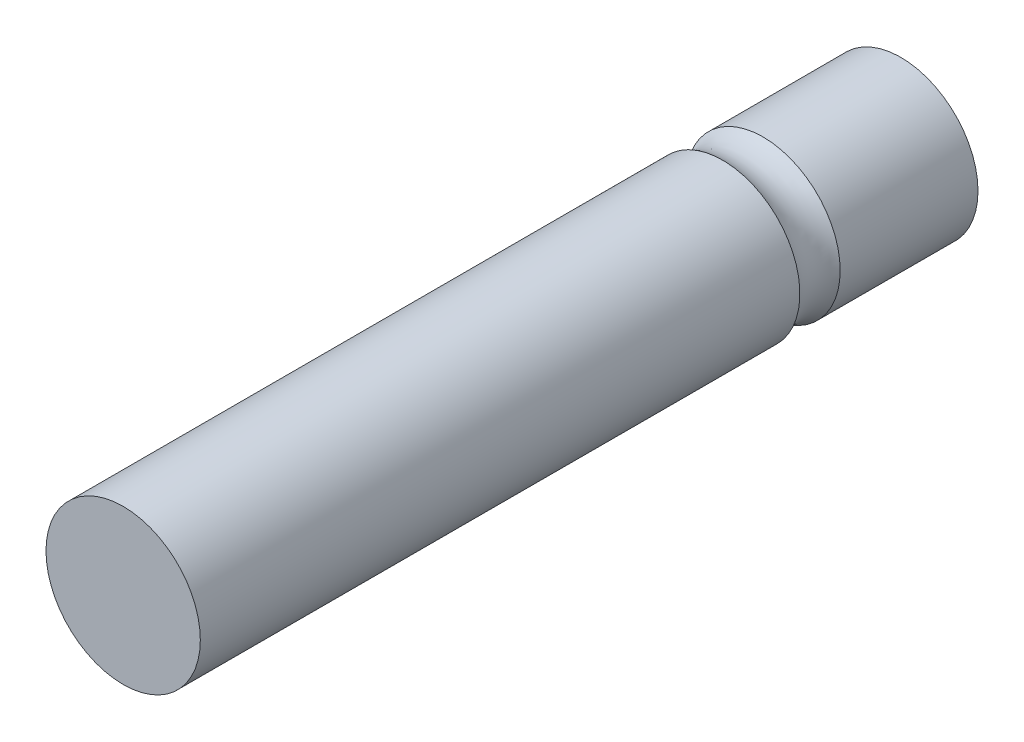
from build123d import *

# Parameters (mm, degrees)
SKETCH1_R           = 3.175
BOSS_EXTRUDE1_DEPTH = 32
SKETCH2_R           = 1.5


with BuildPart() as part:
    # Sketch1 → Boss-Extrude1 (new body)
    with BuildSketch(Plane.XY):
        Circle(SKETCH1_R)
    extrude(amount=BOSS_EXTRUDE1_DEPTH)

    # Sketch2 → Cut-Revolve1 (revolve, cut)
    with BuildSketch(Plane(origin=(0, 0, 0), x_dir=(0, 0, -1), z_dir=(1, 0, 0)), mode=Mode.PRIVATE) as cut_revolve1_sk:
        with Locations((-6.5, 4.425)):
            Circle(SKETCH2_R)
    revolve(cut_revolve1_sk.sketch.rotate(Axis((0, 0, 0), (0, 0, 1)), 90), axis=Axis((0, 0, 0), (0, 0, 1)), mode=Mode.SUBTRACT)


solid = part.part
